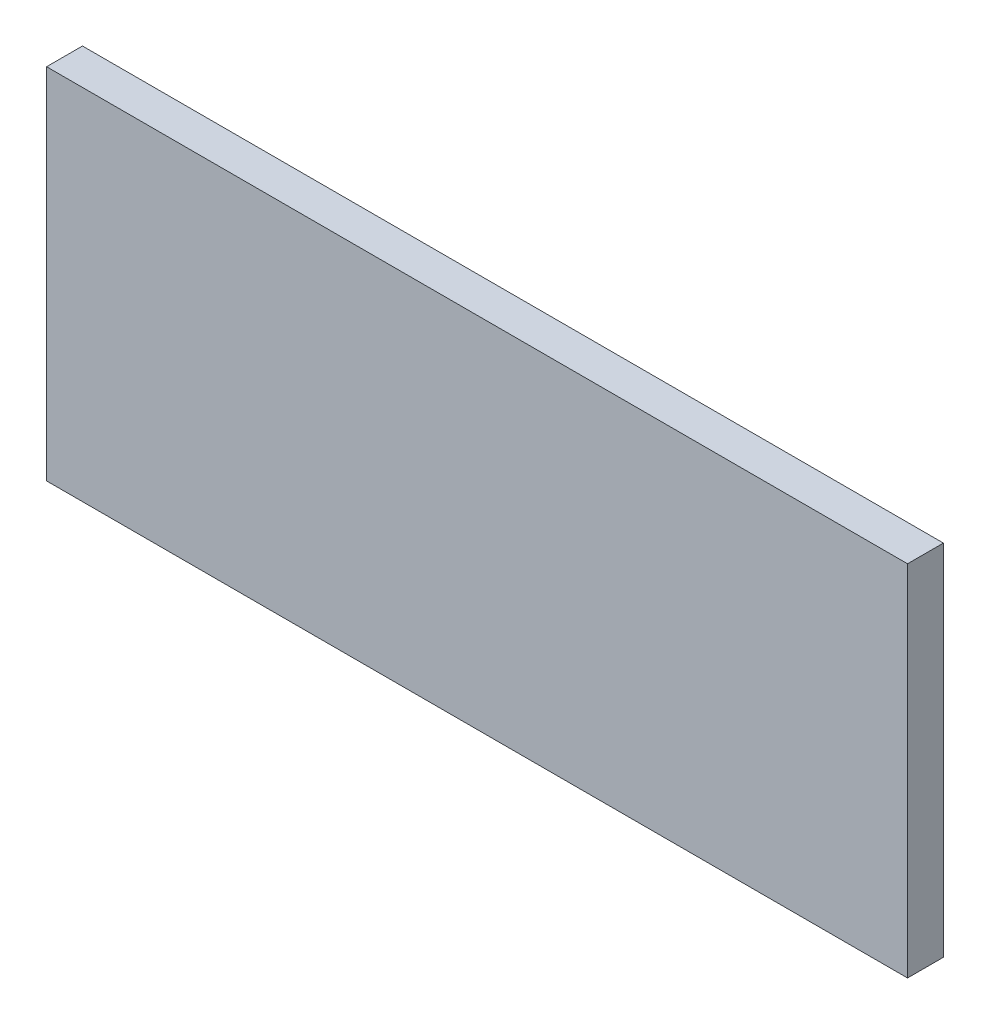
from build123d import *

# Parameters (mm, degrees)
SKETCH1_W           = 152.4
SKETCH1_H           = 63.5
BOSS_EXTRUDE1_DEPTH = 6.35


with BuildPart() as part:
    # Sketch1 → Boss-Extrude1 (new body)
    with BuildSketch(Plane.XY):
        Rectangle(SKETCH1_W, SKETCH1_H)
    extrude(amount=BOSS_EXTRUDE1_DEPTH)


solid = part.part
